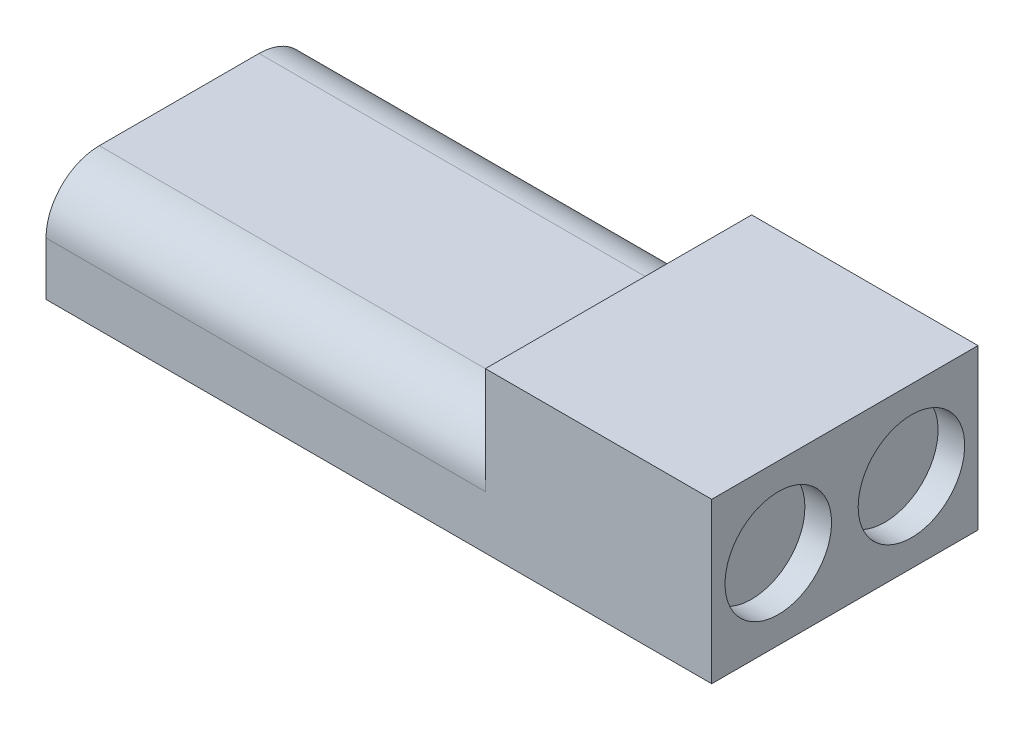
from build123d import *

# Parameters (mm, degrees)
BOSS_EXTRUDE1_DEPTH = 5
FILLET4_R           = 1
CUT_EXTRUDE3_DEPTH  = 10
SKETCH5_R           = 1
CUT_EXTRUDE4_DEPTH  = 0.5


with BuildPart() as part:
    # Sketch1 → Boss-Extrude1 (new body)
    with BuildSketch(Plane.XY):
        Polygon((10.416666667, 3), (10.416666667, 0), (-2.083333333, 0), (-2.083333333, 2), (6.166666667, 2), (6.166666667, 3), align=None)
    extrude(amount=BOSS_EXTRUDE1_DEPTH)

    # Fillet4
    fillet4_edges = [part.edges().sort_by_distance(p)[0] for p in [
        (2.041666667, 2, 5),
        (2.041666667, 2, 0),
    ]]
    fillet(fillet4_edges, radius=FILLET4_R)

    # Sketch2 → Cut-Extrude3 (cut)
    with BuildSketch(Plane.ZY.offset(2.083333333)):
        with BuildLine():
            Line((4.177757267, 0.5), (3.322242733, 0.5))
            ThreePointArc((3.322242733, 0.5), (3.75, 0.927757267), (4.177757267, 0.5))
        make_face()
        with BuildLine():
            Line((0.822242733, 0.5), (1.677757267, 0.5))
            ThreePointArc((1.677757267, 0.5), (1.25, 0.927757267), (0.822242733, 0.5))
        make_face()
    extrude(amount=-CUT_EXTRUDE3_DEPTH, mode=Mode.SUBTRACT)

    # Sketch5 → Cut-Extrude4 (cut)
    with BuildSketch(Plane(origin=(10.416666667, 0, 0), x_dir=(0, 0, -1), z_dir=(1, 0, 0))):
        with Locations((-3.75, 1.5)):
            Circle(SKETCH5_R)
        with Locations(Location((-1.25, 1.5, 0), (0, 0, 180))):
            Circle(SKETCH5_R)
    extrude(amount=-CUT_EXTRUDE4_DEPTH, mode=Mode.SUBTRACT)


solid = part.part
